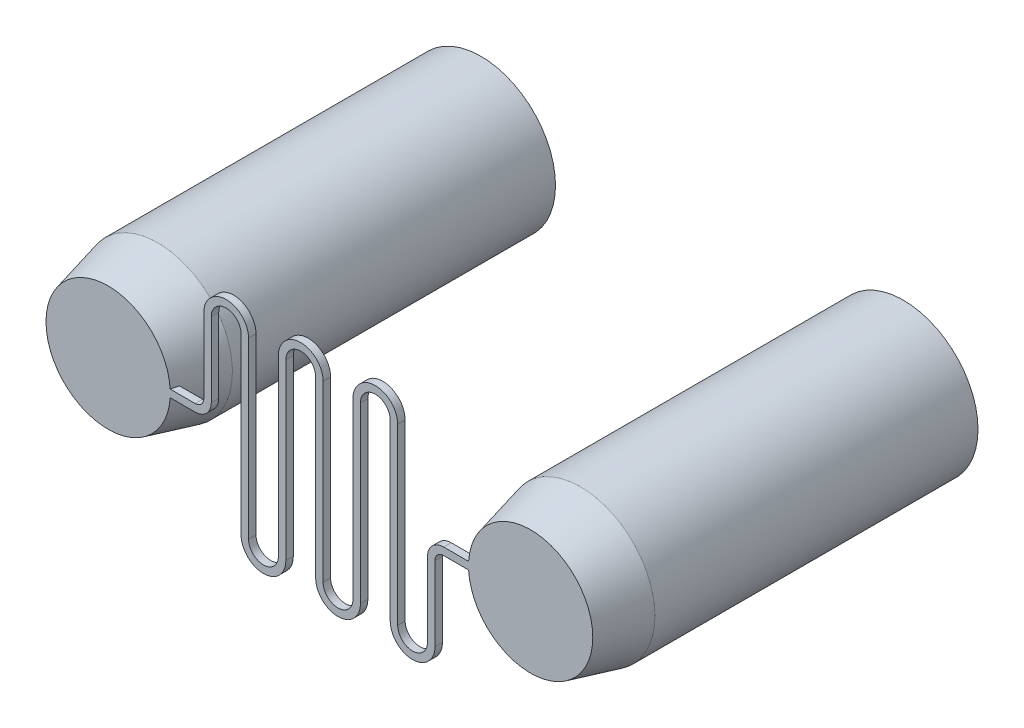
from build123d import *

# Parameters (mm, degrees)
BOSS_EXTRUDE1_DEPTH = 0.6
SKETCH5_R           = 5
CUT_EXTRUDE1_DEPTH  = 27


with BuildPart() as part:
    # Sketch2 → Boss-Extrude1 (new body)
    with BuildSketch(Plane.XY):
        with BuildLine():
            Line((-20.5, -0.3), (-13.5, -0.3))
            ThreePointArc((-13.5, -0.3), (-12.580761184, 0.080761184), (-12.2, 1))
            Line((-12.2, 1), (-12.2, 7))
            ThreePointArc((-12.2, 7), (-11, 8.2), (-9.8, 7))
            Line((-9.8, 7), (-9.8, 0))
            Line((-9.8, 0), (-9.8, -7))
            ThreePointArc((-9.8, -7), (-8, -8.8), (-6.2, -7))
            Line((-6.2, -7), (-6.2, 0))
            Line((-6.2, 0), (-6.2, 7))
            ThreePointArc((-6.2, 7), (-5, 8.2), (-3.8, 7))
            Line((-3.8, 7), (-3.8, 0))
            Line((-3.8, 0), (-3.8, -7))
            ThreePointArc((-3.8, -7), (-2, -8.8), (-0.2, -7))
            Line((-0.2, -7), (-0.2, 0))
            Line((-0.2, 0), (-0.2, 7))
            ThreePointArc((-0.2, 7), (1, 8.2), (2.2, 7))
            Line((2.2, 7), (2.2, 0))
            Line((2.2, 0), (2.2, -7))
            ThreePointArc((2.2, -7), (4, -8.8), (5.8, -7))
            Line((5.8, -7), (5.8, -1))
            ThreePointArc((5.8, -1), (6.005025253, -0.505025253), (6.5, -0.3))
            Line((6.5, -0.3), (13.5, -0.3))
            ThreePointArc((13.5, -0.3), (13.8, 0), (13.5, 0.3))
            Line((13.5, 0.3), (6.5, 0.3))
            ThreePointArc((6.5, 0.3), (5.580761184, -0.080761184), (5.2, -1))
            Line((5.2, -1), (5.2, -7))
            ThreePointArc((5.2, -7), (4, -8.2), (2.8, -7))
            Line((2.8, -7), (2.8, 0))
            Line((2.8, 0), (2.8, 7))
            ThreePointArc((2.8, 7), (1, 8.8), (-0.8, 7))
            Line((-0.8, 7), (-0.8, 0))
            Line((-0.8, 0), (-0.8, -7))
            ThreePointArc((-0.8, -7), (-2, -8.2), (-3.2, -7))
            Line((-3.2, -7), (-3.2, 0))
            Line((-3.2, 0), (-3.2, 7))
            ThreePointArc((-3.2, 7), (-5, 8.8), (-6.8, 7))
            Line((-6.8, 7), (-6.8, 0))
            Line((-6.8, 0), (-6.8, -7))
            ThreePointArc((-6.8, -7), (-8, -8.2), (-9.2, -7))
            Line((-9.2, -7), (-9.2, 0))
            Line((-9.2, 0), (-9.2, 7))
            ThreePointArc((-9.2, 7), (-11, 8.8), (-12.8, 7))
            Line((-12.8, 7), (-12.8, 1))
            ThreePointArc((-12.8, 1), (-13.005025253, 0.505025253), (-13.5, 0.3))
            Line((-13.5, 0.3), (-20.5, 0.3))
            ThreePointArc((-20.5, 0.3), (-20.8, 0), (-20.5, -0.3))
        make_face()
    extrude(amount=BOSS_EXTRUDE1_DEPTH)

    # Sketch3 → Revolve1 (revolve)
    with BuildSketch(Plane(origin=(0, 0, 0), x_dir=(1, 0, 0), z_dir=(0, 1, 0)), mode=Mode.PRIVATE) as revolve1_sk:
        Polygon((-20.5, -0.6), (-25.5, -0.6), (-26.5, 3.4), (-26.5, 29.4), (-20.5, 29.4), align=None)
    revolve(revolve1_sk.sketch.rotate(Axis((-20.5, 0, 0.6), (0, 0, -1)), 176.560187232), axis=Axis((-20.5, 0, 0.6), (0, 0, -1)))

    # Sketch4 → Revolve2 (revolve)
    with BuildSketch(Plane(origin=(0, 0, 0), x_dir=(1, 0, 0), z_dir=(0, 1, 0)), mode=Mode.PRIVATE) as revolve2_sk:
        Polygon((13.5, -0.6), (18.5, -0.6), (19.5, 3.4), (19.5, 29.4), (13.5, 29.4), align=None)
    revolve(revolve2_sk.sketch.rotate(Axis((13.5, 0, 0.6), (0, 0, -1)), 176.660492617), axis=Axis((13.5, 0, 0.6), (0, 0, -1)))

    # Sketch5 → Cut-Extrude1 (cut)
    with BuildSketch(Plane(origin=(0, 0, -29.4), x_dir=(-1, 0, 0), z_dir=(0, 0, -1))):
        with Locations((-13.5, 0)):
            Circle(SKETCH5_R)
        with Locations((20.5, 0)):
            Circle(SKETCH5_R)
    extrude(amount=-CUT_EXTRUDE1_DEPTH, mode=Mode.SUBTRACT)


solid = part.part
